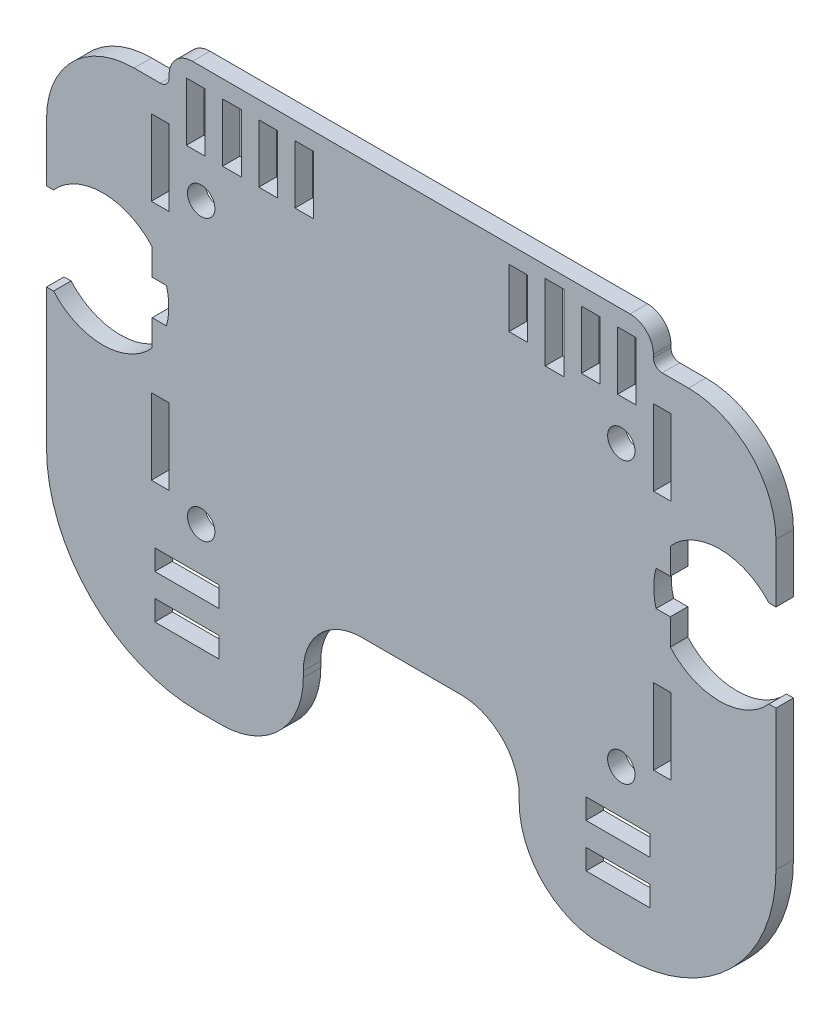
from build123d import *

# Parameters (mm, degrees)
SKICA2_R                = 2.35
SKICA2_W                = 11
SKICA2_H                = 3.499027085
SKICA2_W_2              = 3
SKICA2_H_2              = 13
SKICA2_W_3              = 3.2
SKICA2_H_3              = 10
SKICA2_W_4              = 3.215746781
P_IDAT_VYSUNUT_M1_DEPTH = 3


with BuildPart() as part:
    # Skica2 → Přidat vysunutím1 (new body)
    with BuildSketch(Plane.XY):
        with BuildLine():
            Line((-62.5, 7.5), (-61.3, 7.5))
            ThreePointArc((-61.3, 7.5), (-52.847781356, 11.3), (-44.395562713, 7.5))
            Line((-44.395562713, 7.5), (-44.395562713, 3))
            Line((-44.395562713, 3), (-41.953287334, 3))
            ThreePointArc((-41.953287334, 3), (-41.547781356, 0), (-41.953287334, -3))
            Line((-41.953287334, -3), (-44.395562713, -3))
            Line((-44.395562713, -3), (-44.395562713, -7.5))
            ThreePointArc((-44.395562713, -7.5), (-52.847781356, -11.3), (-61.3, -7.5))
            Line((-61.3, -7.5), (-62.5, -7.5))
            Line((-62.5, -7.5), (-62.5, -16.780342451))
            Line((-62.5, -16.780342451), (-62.5, -31.5))
            ThreePointArc((-62.5, -31.5), (-54.884776311, -49.884776311), (-36.5, -57.5))
            Line((-36.5, -57.5), (-32.5, -57.5))
            ThreePointArc((-32.5, -57.5), (-22.600505063, -53.399494937), (-18.5, -43.5))
            Line((-18.5, -43.5), (-18.5, -42.5))
            ThreePointArc((-18.5, -42.5), (-15.571067812, -35.428932188), (-8.5, -32.5))
            Line((-8.5, -32.5), (8.5, -32.5))
            ThreePointArc((8.5, -32.5), (15.571067812, -35.428932188), (18.5, -42.5))
            Line((18.5, -42.5), (18.5, -43.5))
            ThreePointArc((18.5, -43.5), (22.600505063, -53.399494937), (32.5, -57.5))
            Line((32.5, -57.5), (36.5, -57.5))
            ThreePointArc((36.5, -57.5), (54.884776311, -49.884776311), (62.5, -31.5))
            Line((62.5, -31.5), (62.5, -18.974988021))
            Line((62.5, -18.974988021), (62.5, -7.5))
            Line((62.5, -7.5), (61.3, -7.5))
            ThreePointArc((61.3, -7.5), (52.847781356, -11.3), (44.395562713, -7.5))
            Line((44.395562713, -7.5), (44.395562713, -3))
            Line((44.395562713, -3), (41.953287334, -3))
            ThreePointArc((41.953287334, -3), (41.547781356, 0), (41.953287334, 3))
            Line((41.953287334, 3), (44.395562713, 3))
            Line((44.395562713, 3), (44.395562713, 7.5))
            ThreePointArc((44.395562713, 7.5), (52.847781356, 11.3), (61.3, 7.5))
            Line((61.3, 7.5), (62.5, 7.5))
            Line((62.5, 7.5), (62.5, 17.5))
            ThreePointArc((62.5, 17.5), (58.106601718, 28.106601718), (47.5, 32.5))
            Line((47.5, 32.5), (43, 32.5))
            ThreePointArc((43, 32.5), (41.939339828, 32.939339828), (41.5, 34))
            Line((41.5, 34), (41.5, 34.5))
            ThreePointArc((41.5, 34.5), (40.328427125, 37.328427125), (37.5, 38.5))
            Line((37.5, 38.5), (-37.5, 38.5))
            ThreePointArc((-37.5, 38.5), (-40.328427125, 37.328427125), (-41.5, 34.5))
            Line((-41.5, 34.5), (-41.5, 34))
            ThreePointArc((-41.5, 34), (-41.939339828, 32.939339828), (-43, 32.5))
            Line((-43, 32.5), (-47.5, 32.5))
            ThreePointArc((-47.5, 32.5), (-58.106601718, 28.106601718), (-62.5, 17.5))
            Line((-62.5, 17.5), (-62.5, 7.5))
        make_face()
        with Locations((-36, 18.55)):
            Circle(SKICA2_R, mode=Mode.SUBTRACT)
        with Locations((-36, -29.45)):
            Circle(SKICA2_R, mode=Mode.SUBTRACT)
        with Locations((36, -29.45)):
            Circle(SKICA2_R, mode=Mode.SUBTRACT)
        with Locations((36, 18.55)):
            Circle(SKICA2_R, mode=Mode.SUBTRACT)
        with Locations((-38.447781356, -46.193013209)):
            Rectangle(SKICA2_W, SKICA2_H, mode=Mode.SUBTRACT)
        with Locations((-38.447781356, -38.693986123)):
            Rectangle(SKICA2_W, SKICA2_H, mode=Mode.SUBTRACT)
        with Locations((-43.047781356, -20.7)):
            Rectangle(SKICA2_W_2, SKICA2_H_2, mode=Mode.SUBTRACT)
        with Locations((-43.047781356, 20.7)):
            Rectangle(SKICA2_W_2, SKICA2_H_2, mode=Mode.SUBTRACT)
        with Locations((43.047781356, -20.7)):
            Rectangle(SKICA2_W_2, SKICA2_H_2, mode=Mode.SUBTRACT)
        with Locations((43.047781356, 20.7)):
            Rectangle(SKICA2_W_2, SKICA2_H_2, mode=Mode.SUBTRACT)
        with Locations((-36.947781356, 30.5)):
            Rectangle(SKICA2_W_3, SKICA2_H_3, mode=Mode.SUBTRACT)
        with Locations((36.947781356, 30.5)):
            Rectangle(SKICA2_W_3, SKICA2_H_3, mode=Mode.SUBTRACT)
        with Locations((30.747781356, 30.5)):
            Rectangle(SKICA2_W_3, SKICA2_H_3, mode=Mode.SUBTRACT)
        with Locations((24.547781356, 30)):
            Rectangle(SKICA2_W_3, SKICA2_H_2, mode=Mode.SUBTRACT)
        with Locations((35.447781356, -38.693986123)):
            Rectangle(SKICA2_W, SKICA2_H, mode=Mode.SUBTRACT)
        with Locations((-30.739907966, 30.5)):
            Rectangle(SKICA2_W_4, SKICA2_H_3, mode=Mode.SUBTRACT)
        with Locations((-24.532034575, 30.5)):
            Rectangle(SKICA2_W_3, SKICA2_H_3, mode=Mode.SUBTRACT)
        with Locations((-18.332034575, 30.5)):
            Rectangle(SKICA2_W_3, SKICA2_H_3, mode=Mode.SUBTRACT)
        with Locations((18.347781356, 30.5)):
            Rectangle(SKICA2_W_3, SKICA2_H_3, mode=Mode.SUBTRACT)
        with Locations((35.447781356, -46.193013209)):
            Rectangle(SKICA2_W, SKICA2_H, mode=Mode.SUBTRACT)
    extrude(amount=P_IDAT_VYSUNUT_M1_DEPTH)


solid = part.part
